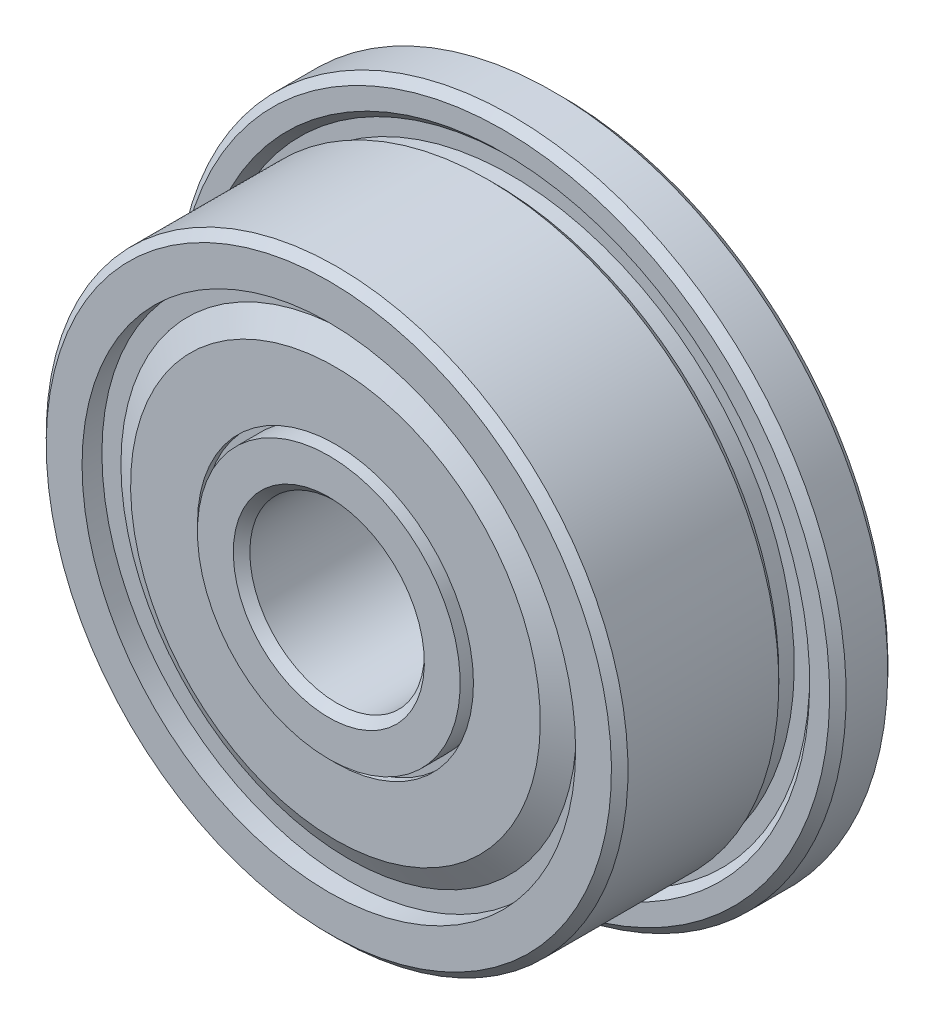
from build123d import *

# Parameters (mm, degrees)
FILLET1_SIZE      = 0.1421875
FILLET2_SIZE      = 0.1421875
CIRPATTERN3_COUNT = 9
SKETCH8_W         = 0.455
SKETCH8_H         = 0.379166667


with BuildPart() as part:
    # Sketch2 → Revolve1 (revolve)
    with BuildSketch(Plane(origin=(0, 0, 0), x_dir=(0, 0, -1), z_dir=(1, 0, 0)), mode=Mode.PRIVATE) as revolve1_sk:
        with BuildLine():
            Line((2, 5.75), (1, 5.75))
            Line((1, 5.75), (1, 5.265165043))
            Line((1, 5.265165043), (1.132582521, 5.132582521))
            Line((1.132582521, 5.132582521), (1.132582521, 4.867417479))
            Line((1.132582521, 4.867417479), (0.867417479, 4.867417479))
            Line((0.867417479, 4.867417479), (0.734834957, 5))
            Line((0.734834957, 5), (-2, 5))
            Line((-2, 5), (-2, 3.8625))
            Line((-2, 3.8625), (-0.505252165, 3.8625))
            ThreePointArc((-0.505252165, 3.8625), (0, 4.044), (0.505252165, 3.8625))
            Line((0.505252165, 3.8625), (2, 3.8625))
            Line((2, 3.8625), (2, 5.75))
        make_face()
        with BuildLine():
            Line((2, 1.5), (-2, 1.5))
            Line((-2, 1.5), (-2, 2.6375))
            Line((-2, 2.6375), (-0.505252165, 2.6375))
            ThreePointArc((-0.505252165, 2.6375), (0, 2.456), (0.505252165, 2.6375))
            Line((0.505252165, 2.6375), (2, 2.6375))
            Line((2, 2.6375), (2, 1.5))
        make_face()
    revolve(revolve1_sk.sketch.rotate(Axis((0, 0, 0), (0, 0, -1)), 180), axis=Axis((0, 0, 0), (0, 0, -1)))

    # Fillet1
    fillet1_edges = [part.edges().sort_by_distance(p)[0] for p in [
        (0, 5, 2),
        (0, 5.75, -2),
        (0, 5.75, -1),
    ]]
    chamfer(fillet1_edges, length=FILLET1_SIZE)

    # Fillet2
    fillet2_edges = [part.edges().sort_by_distance(p)[0] for p in [
        (0, 1.5, -2),
        (0, 1.5, 2),
    ]]
    chamfer(fillet2_edges, length=FILLET2_SIZE)

    # Sketch8 → Cut-Revolve1 (revolve, cut)
    with BuildSketch(Plane(origin=(0, 0, 0), x_dir=(0, 0, -1), z_dir=(1, 0, 0)), mode=Mode.PRIVATE) as cut_revolve1_sk:
        with Locations((-1.7725, 4.052083334)):
            Rectangle(SKETCH8_W, SKETCH8_H)
        with Locations((1.7725, 4.052083334)):
            Rectangle(SKETCH8_W, SKETCH8_H)
        with Locations((1.7725, 2.447916667)):
            Rectangle(SKETCH8_W, SKETCH8_H)
        with Locations((-1.7725, 2.447916667)):
            Rectangle(SKETCH8_W, SKETCH8_H)
    revolve(cut_revolve1_sk.sketch.rotate(Axis((0, 0, 0), (0, 0, -1)), 180), axis=Axis((0, 0, 0), (0, 0, -1)), mode=Mode.SUBTRACT)


with BuildPart() as body_2:
    # Sketch7 → Revolve3 (revolve)
    with BuildSketch(Plane.XY):
        with BuildLine():
            Line((0, 4.044), (0, 2.456))
            ThreePointArc((0, 2.456), (-0.794, 3.25), (0, 4.044))
        make_face()
    revolve(axis=Axis((0, 4.044, 0), (0, -1, 0)))


with BuildPart() as cirpattern3_1:
    # CirPattern3: pattern copy
    add(body_2.part.rotate(Axis((0, 0, 0), (0, 0, 1)), 1 * 360 / CIRPATTERN3_COUNT))


with BuildPart() as cirpattern3_2:
    # CirPattern3: pattern copy
    add(body_2.part.rotate(Axis((0, 0, 0), (0, 0, 1)), 2 * 360 / CIRPATTERN3_COUNT))


with BuildPart() as cirpattern3_3:
    # CirPattern3: pattern copy
    add(body_2.part.rotate(Axis((0, 0, 0), (0, 0, 1)), 3 * 360 / CIRPATTERN3_COUNT))


with BuildPart() as cirpattern3_4:
    # CirPattern3: pattern copy
    add(body_2.part.rotate(Axis((0, 0, 0), (0, 0, 1)), 4 * 360 / CIRPATTERN3_COUNT))


with BuildPart() as cirpattern3_5:
    # CirPattern3: pattern copy
    add(body_2.part.rotate(Axis((0, 0, 0), (0, 0, 1)), 5 * 360 / CIRPATTERN3_COUNT))


with BuildPart() as cirpattern3_6:
    # CirPattern3: pattern copy
    add(body_2.part.rotate(Axis((0, 0, 0), (0, 0, 1)), 6 * 360 / CIRPATTERN3_COUNT))


with BuildPart() as cirpattern3_7:
    # CirPattern3: pattern copy
    add(body_2.part.rotate(Axis((0, 0, 0), (0, 0, 1)), 7 * 360 / CIRPATTERN3_COUNT))


with BuildPart() as cirpattern3_8:
    # CirPattern3: pattern copy
    add(body_2.part.rotate(Axis((0, 0, 0), (0, 0, 1)), 8 * 360 / CIRPATTERN3_COUNT))


with BuildPart() as body_11:
    # Sketch9 → Revolve4 (revolve)
    with BuildSketch(Plane(origin=(0, 0, 0), x_dir=(0, 0, -1), z_dir=(1, 0, 0)), mode=Mode.PRIVATE) as revolve4_sk:
        Polygon((-1.545, 4.241666667), (-1.545, 3.88452381), (-1.7725, 3.490482251), (-1.7725, 2.372083333), (-1.88625, 2.372083333), (-1.88625, 3.520961471), (-1.65875, 3.91500303), (-1.65875, 4.241666667), align=None)
        Polygon((1.545, 4.241666667), (1.545, 3.88452381), (1.7725, 3.490482251), (1.7725, 2.372083333), (1.88625, 2.372083333), (1.88625, 3.520961471), (1.65875, 3.91500303), (1.65875, 4.241666667), align=None)
    revolve(revolve4_sk.sketch.rotate(Axis((0, 0, 0), (0, 0, -1)), 180), axis=Axis((0, 0, 0), (0, 0, -1)))


solid = Compound([part.part, body_2.part, cirpattern3_1.part, cirpattern3_2.part, cirpattern3_3.part, cirpattern3_4.part, cirpattern3_5.part, cirpattern3_6.part, cirpattern3_7.part, cirpattern3_8.part, body_11.part])
